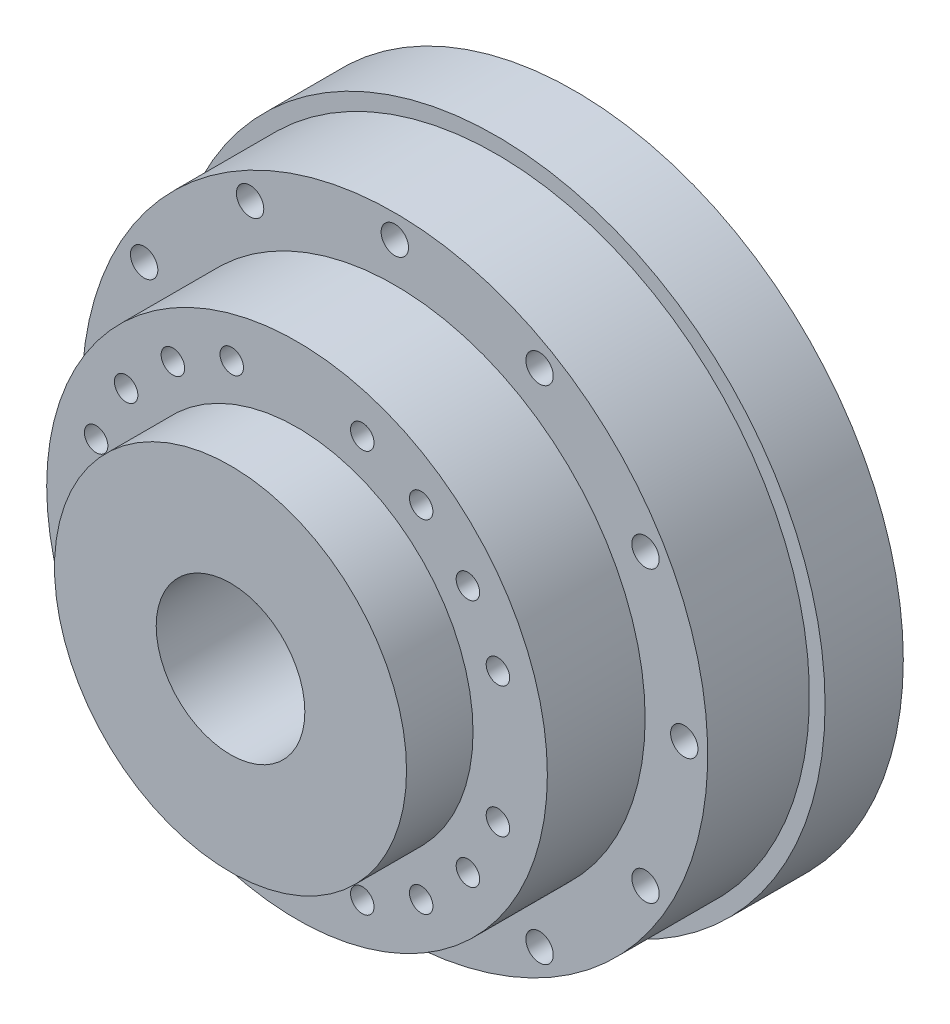
from build123d import *

# Parameters (mm, degrees)
SKETCH_1_R               = 42
EXTRUDE_1_DEPTH          = 10
SKETCH_2_R               = 40
EXTRUDE_2_DEPTH          = 13
SKETCH_3_R               = 32
EXTRUDE_3_DEPTH          = 12.5
SKETCH_4_R               = 22.5
EXTRUDE_4_DEPTH          = 8.5
EXTRUDE_START            = 5.5
SKETCH_5_R               = 22.5
EXTRUDE_5_DEPTH          = 5.5
SKETCH_6_R               = 12.5
EXTRUDE_6_DEPTH          = 7
SKETCH_7_R               = 9.5
CUT_EXTRUDE_1_DEPTH      = 56.5
SKETCH_8_R               = 1.75
CUT_EXTRUDE_2_DEPTH      = 23
SKETCH_9_R               = 1.5
CUT_EXTRUDE_3_DEPTH      = 10
CUT_EXTRUDE_4_REACH      = 83.672
CUT_EXTRUDE_4_END_RADIUS = 9.5
SKETCH_11_R              = 1.5
PATTERN_CIRCULAR_1_COUNT = 3


with BuildPart() as part:
    # Эскиз1 → Бобышка-Вытянуть1 (new body)
    with BuildSketch(Plane.XY):
        Circle(SKETCH_1_R)
    extrude(amount=EXTRUDE_1_DEPTH)

    # Эскиз2 → Бобышка-Вытянуть2 (add)
    with BuildSketch(Plane.XY.offset(10)):
        with Locations(Location((0, 0, 0), (0, 0, 180))):
            Circle(SKETCH_2_R)
    extrude(amount=EXTRUDE_2_DEPTH)

    # Эскиз3 → Бобышка-Вытянуть3 (add)
    with BuildSketch(Plane.XY.offset(23)):
        Circle(SKETCH_3_R)
    extrude(amount=EXTRUDE_3_DEPTH)

    # Эскиз4 → Бобышка-Вытянуть4 (add)
    with BuildSketch(Plane.XY.offset(35.5)):
        Circle(SKETCH_4_R)
    extrude(amount=EXTRUDE_4_DEPTH)

    # Эскиз5 → Бобышка-Вытянуть5 (add)
    with BuildSketch(Plane(origin=(0, 0, 0), x_dir=(-1, 0, 0), z_dir=(0, 0, -1)).offset(EXTRUDE_START)):
        with Locations(Location((0, 0, 0), (0, 0, 180))):
            Circle(SKETCH_5_R)
    extrude(amount=-EXTRUDE_5_DEPTH)

    # Эскиз6 → Бобышка-Вытянуть6 (add)
    with BuildSketch(Plane(origin=(0, 0, -5.5), x_dir=(-1, 0, 0), z_dir=(0, 0, -1))):
        Circle(SKETCH_6_R)
    extrude(amount=EXTRUDE_6_DEPTH)

    # Эскиз7 → Вырез-Вытянуть1 (cut)
    with BuildSketch(Plane(origin=(0, 0, -12.5), x_dir=(-1, 0, 0), z_dir=(0, 0, -1))):
        Circle(SKETCH_7_R)
    extrude(amount=-CUT_EXTRUDE_1_DEPTH, mode=Mode.SUBTRACT)

    # Эскиз8 → Вырез-Вытянуть2 (cut)
    with BuildSketch(Plane.XY.offset(23)):
        with Locations((0, 37)):
            Circle(SKETCH_8_R)
        with Locations((18.5, 32.04293994)):
            Circle(SKETCH_8_R)
        with Locations((32.04293994, 18.5)):
            Circle(SKETCH_8_R)
        with Locations((37, 0)):
            Circle(SKETCH_8_R)
        with Locations((32.04293994, -18.5)):
            Circle(SKETCH_8_R)
        with Locations((18.5, -32.04293994)):
            Circle(SKETCH_8_R)
        with Locations((0, -37)):
            Circle(SKETCH_8_R)
        with Locations((-18.5, -32.04293994)):
            Circle(SKETCH_8_R)
        with Locations((-32.04293994, -18.5)):
            Circle(SKETCH_8_R)
        with Locations((-37, 0)):
            Circle(SKETCH_8_R)
        with Locations((-32.04293994, 18.5)):
            Circle(SKETCH_8_R)
        with Locations((-18.5, 32.04293994)):
            Circle(SKETCH_8_R)
    extrude(amount=-CUT_EXTRUDE_2_DEPTH, mode=Mode.SUBTRACT)

    # Эскиз9 → Вырез-Вытянуть3 (cut)
    with BuildSketch(Plane.XY.offset(35.5)):
        with Locations((-8.343458848, 25.67852594)):
            Circle(SKETCH_9_R)
        with Locations((8.343458848, 25.67852594)):
            Circle(SKETCH_9_R)
        with Locations((15.870201812, 21.843458848)):
            Circle(SKETCH_9_R)
        with Locations((21.843458848, 15.870201812)):
            Circle(SKETCH_9_R)
        with Locations((25.67852594, 8.343458848)):
            Circle(SKETCH_9_R)
        with Locations((25.67852594, -8.343458848)):
            Circle(SKETCH_9_R)
        with Locations((21.843458848, -15.870201812)):
            Circle(SKETCH_9_R)
        with Locations((15.870201812, -21.843458848)):
            Circle(SKETCH_9_R)
        with Locations((8.343458848, -25.67852594)):
            Circle(SKETCH_9_R)
        with Locations((-8.343458848, -25.67852594)):
            Circle(SKETCH_9_R)
        with Locations((-15.870201812, -21.843458848)):
            Circle(SKETCH_9_R)
        with Locations((-21.843458848, -15.870201812)):
            Circle(SKETCH_9_R)
        with Locations((-25.67852594, -8.343458848)):
            Circle(SKETCH_9_R)
        with Locations((-25.67852594, 8.343458848)):
            Circle(SKETCH_9_R)
        with Locations((-21.843458848, 15.870201812)):
            Circle(SKETCH_9_R)
        with Locations((-15.870201812, 21.843458848)):
            Circle(SKETCH_9_R)
    extrude(amount=-CUT_EXTRUDE_3_DEPTH, mode=Mode.SUBTRACT)

    # Вырез-Вытянуть4: up to this cylinder (the profile starts outside it)
    cut_extrude_4_end = Plane(origin=(0, 0, -10), z_dir=(0, 0, -1)) * Cylinder(CUT_EXTRUDE_4_END_RADIUS, 187.344, mode=Mode.PRIVATE)
    # Эскиз11 → Вырез-Вытянуть4 (cut, up to the surface)
    with BuildSketch(Plane(origin=(0, 12.5, 0), x_dir=(1, 0, 0), z_dir=(0, 1, 0)), mode=Mode.PRIVATE) as cut_extrude_4_sk1:
        with Locations(Location((0, 10, 0), (0, 0, 270))):
            Circle(SKETCH_11_R)
    cut_extrude_4_tool1 = extrude(cut_extrude_4_sk1.sketch, amount=-CUT_EXTRUDE_4_REACH, mode=Mode.PRIVATE) - cut_extrude_4_end
    cut_extrude_4 = cut_extrude_4_tool1.solids().sort_by_distance((0, 12.5, -10))[0]
    add(cut_extrude_4, mode=Mode.SUBTRACT)

    # Круговой массив1: Вырез-Вытянуть4 ×3 about axis
    pattern_circular_1_axis = Axis((0, 0, 70.870057685), (0, 0, -1))
    for i in range(1, PATTERN_CIRCULAR_1_COUNT):
        add(cut_extrude_4.rotate(pattern_circular_1_axis, i * 360 / PATTERN_CIRCULAR_1_COUNT), mode=Mode.SUBTRACT)


solid = part.part
